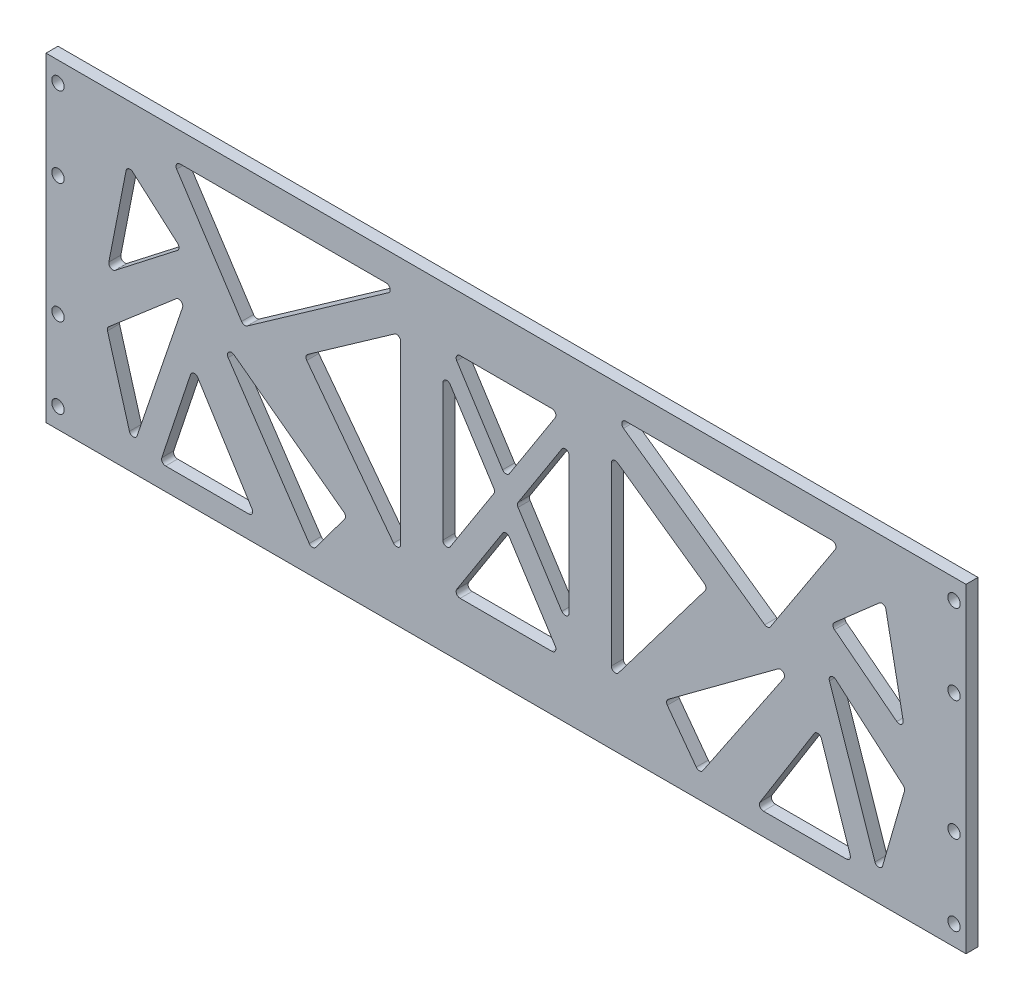
from build123d import *

# Parameters (mm, degrees)
SKETCH_1_W             = 230
SKETCH_1_H             = 80
EXTRUDE_1_DEPTH        = 3
SKETCH_2_R             = 1.55
CUT_EXTRUDE_1_DEPTH    = 3
CUT_EXTRUDE_3_DEPTH    = 3
FILLET_1_R             = 1
CUT_EXTRUDE_4_DEPTH    = 3
FILLET_2_R             = 1
FILLET_2_OF_MIRROR_2_R = 1


with BuildPart() as part:
    # 草图1 → 凸台-拉伸1 (new body)
    with BuildSketch(Plane.XY):
        Rectangle(SKETCH_1_W, SKETCH_1_H)
    extrude(amount=EXTRUDE_1_DEPTH)

    # 草图2 → 切除-拉伸1 (cut)
    with BuildSketch(Plane.XY.offset(3)):
        with Locations((-112, 35)):
            Circle(SKETCH_2_R)
        with Locations((-112, 15)):
            Circle(SKETCH_2_R)
        with Locations((-112, -15)):
            Circle(SKETCH_2_R)
        with Locations((-112, -35)):
            Circle(SKETCH_2_R)
    cut_extrude_1 = extrude(amount=-CUT_EXTRUDE_1_DEPTH, mode=Mode.SUBTRACT)

    # 镜向1: 切除-拉伸1 across plane
    add(cut_extrude_1.mirror(Plane(origin=(0, 0, 0), x_dir=(0, 0, 1), z_dir=(1, 0, 0))), mode=Mode.SUBTRACT)

    # 草图3 → 切除-拉伸3 (cut)
    with BuildSketch(Plane.XY.offset(3)):
        Polygon((-13.305143171, 26.275790798), (13.305143171, 26.275790798), (0, 5.552735947), align=None)
        Polygon((-15.79638841, 21.645852354), (-15.79638841, -19.238624417), (-2.671542174, 1.203613969), align=None)
        Polygon((13.305143171, -26.275790798), (0, -5.552735947), (-13.305143171, -26.275790798), align=None)
        Polygon((15.79638841, -19.238624417), (2.671542174, 1.203613969), (15.79638841, 21.645852354), align=None)
    extrude(amount=-CUT_EXTRUDE_3_DEPTH, mode=Mode.SUBTRACT)

    # 圆角1
    fillet_1_edges = [part.edges().sort_by_distance(p)[0] for p in [
        (13.305143171, -26.275790798, 1.5),
        (-13.305143171, -26.275790798, 1.5),
        (0, -5.552735947, 1.5),
        (-2.671542174, 1.203613969, 1.5),
        (-15.79638841, -19.238624417, 1.5),
        (-15.79638841, 21.645852354, 1.5),
        (15.79638841, 21.645852354, 1.5),
        (15.79638841, -19.238624417, 1.5),
        (2.671542174, 1.203613969, 1.5),
        (13.305143171, 26.275790798, 1.5),
        (0, 5.552735947, 1.5),
        (-13.305143171, 26.275790798, 1.5),
    ]]
    fillet(fillet_1_edges, radius=FILLET_1_R)

    # 草图4 → 切除-拉伸4 (cut)
    with BuildSketch(Plane.XY.offset(3)):
        Polygon((-94.647300932, 26.28167583), (-99.803832265, 0), (-81.173783576, 14.471555678), align=None)
        Polygon((-83.336199942, 32.768924927), (-26.780694991, 32.768924927), (-65.537849854, 5.489210775), align=None)
        Polygon((-79.676726092, 5.489210775), (-99.803832265, -11.810120151), (-93.256525701, -34.501763578), align=None)
        Polygon((-72.690457833, 1.663397204), (-39.739437394, -22.7240812), (-48.404858649, -34.432322132), align=None)
        Polygon((-78.179668608, -9.458541946), (-86.494255189, -34.432322132), (-62.543734886, -34.432322132), align=None)
        Polygon((-50.432218288, 6.882727449), (-26.319327505, 23.854890919), (-26.319327505, -25.008988453), align=None)
    cut_extrude_4 = extrude(amount=-CUT_EXTRUDE_4_DEPTH, mode=Mode.SUBTRACT)

    # 圆角2
    fillet_2_edges = [part.edges().sort_by_distance(p)[0] for p in [
        (-48.404858649, -34.432322132, 1.5),
        (-72.690457833, 1.663397204, 1.5),
        (-39.739437394, -22.7240812, 1.5),
        (-78.179668608, -9.458541946, 1.5),
        (-62.543734886, -34.432322132, 1.5),
        (-86.494255189, -34.432322132, 1.5),
        (-65.537849854, 5.489210775, 1.5),
        (-83.336199942, 32.768924927, 1.5),
        (-26.780694991, 32.768924927, 1.5),
        (-79.676726092, 5.489210775, 1.5),
        (-93.256525701, -34.501763578, 1.5),
        (-99.803832265, -11.810120151, 1.5),
        (-26.319327505, -25.008988453, 1.5),
        (-50.432218288, 6.882727449, 1.5),
        (-26.319327505, 23.854890919, 1.5),
        (-94.647300932, 26.28167583, 1.5),
        (-81.173783576, 14.471555678, 1.5),
        (-99.803832265, 0, 1.5),
    ]]
    fillet(fillet_2_edges, radius=FILLET_2_R)

    # 镜向2: 切除-拉伸4 across plane
    add(cut_extrude_4.mirror(Plane(origin=(0, 0, 0), x_dir=(0, 0, 1), z_dir=(1, 0, 0))), mode=Mode.SUBTRACT)

    # 圆角2 of 镜向2
    fillet_2_of_mirror_2_edges = [part.edges().sort_by_distance(p)[0] for p in [
        (48.404858649, -34.432322132, 1.5),
        (72.690457833, 1.663397204, 1.5),
        (39.739437394, -22.7240812, 1.5),
        (78.179668608, -9.458541946, 1.5),
        (62.543734886, -34.432322132, 1.5),
        (86.494255189, -34.432322132, 1.5),
        (65.537849854, 5.489210775, 1.5),
        (83.336199942, 32.768924927, 1.5),
        (26.780694991, 32.768924927, 1.5),
        (79.676726092, 5.489210775, 1.5),
        (93.256525701, -34.501763578, 1.5),
        (99.803832265, -11.810120151, 1.5),
        (26.319327505, -25.008988453, 1.5),
        (50.432218288, 6.882727449, 1.5),
        (26.319327505, 23.854890919, 1.5),
        (94.647300932, 26.28167583, 1.5),
        (81.173783576, 14.471555678, 1.5),
        (99.803832265, 0, 1.5),
    ]]
    fillet(fillet_2_of_mirror_2_edges, radius=FILLET_2_OF_MIRROR_2_R)


solid = part.part
